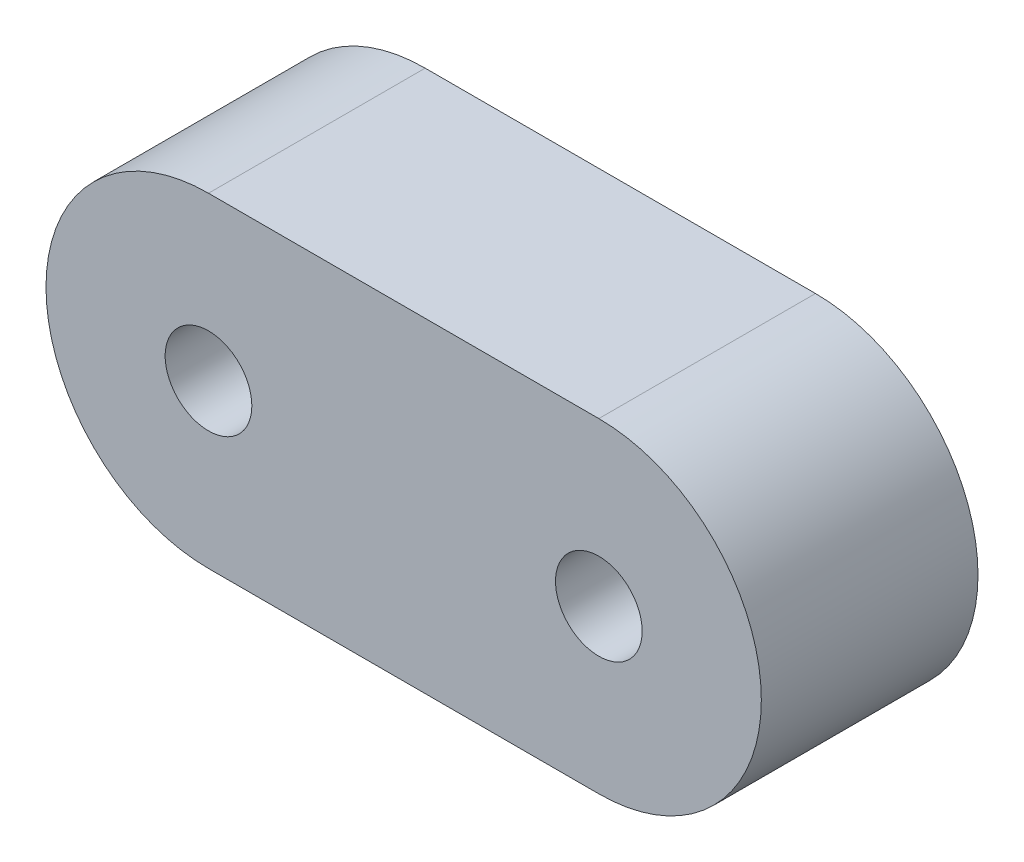
from build123d import *

# Parameters (mm, degrees)
SKETCH_1_R      = 4
EXTRUDE_1_DEPTH = 20


with BuildPart() as part:
    # 草图1 → 凸台-拉伸1 (new body)
    with BuildSketch(Plane.XY):
        with BuildLine():
            Line((0, 15), (36.03, 15))
            ThreePointArc((36.03, 15), (51.03, 0), (36.03, -15))
            Line((36.03, -15), (0, -15))
            ThreePointArc((0, -15), (-15, 0), (0, 15))
        make_face()
        Circle(SKETCH_1_R, mode=Mode.SUBTRACT)
        with Locations((36.03, 0)):
            Circle(SKETCH_1_R, mode=Mode.SUBTRACT)
    extrude(amount=EXTRUDE_1_DEPTH)


solid = part.part
